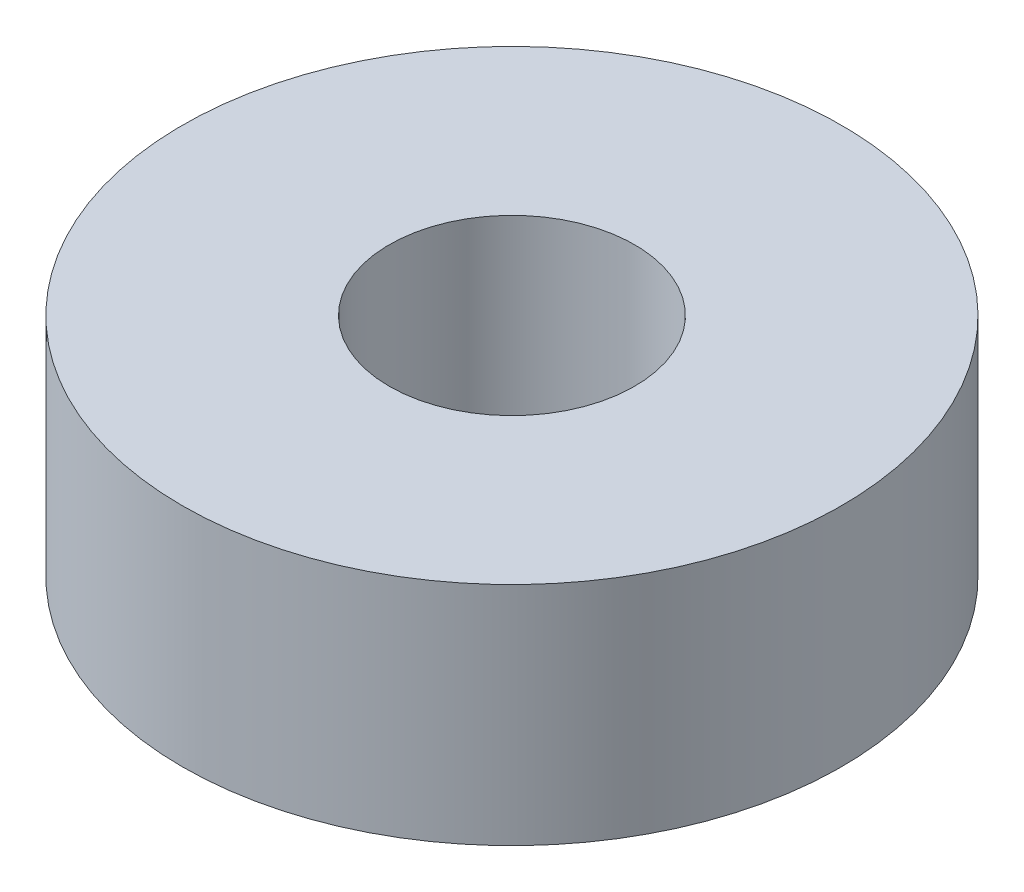
from build123d import *

# Parameters (mm, degrees)
SKETCH1_R           = 6.85
SKETCH1_R_2         = 2.55
BOSS_EXTRUDE1_DEPTH = 4.7


with BuildPart() as part:
    # Sketch1 → Boss-Extrude1 (new body)
    with BuildSketch(Plane(origin=(0, 0, 0), x_dir=(1, 0, 0), z_dir=(0, 1, 0))):
        with Locations(Location((0, 0, 0), (0, 0, 270))):
            Circle(SKETCH1_R)
        with Locations(Location((0, 0, 0), (0, 0, 270))):
            Circle(SKETCH1_R_2, mode=Mode.SUBTRACT)
    extrude(amount=BOSS_EXTRUDE1_DEPTH)


solid = part.part
